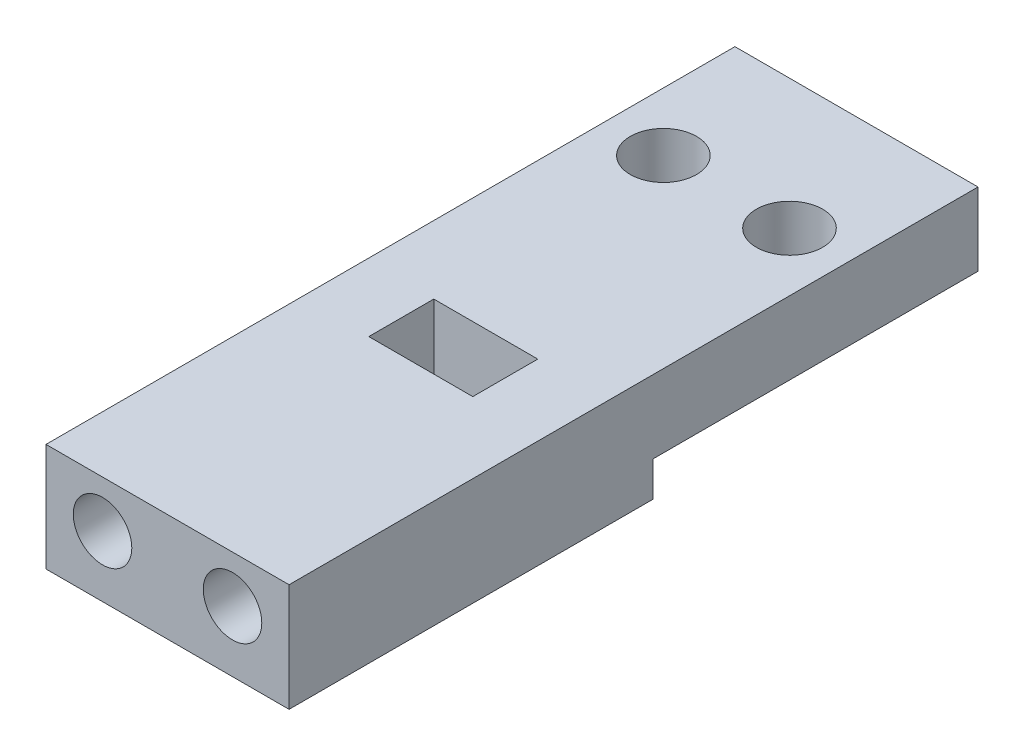
from build123d import *

# Parameters (mm, degrees)
SKETCH_1_W           = 22.333333334
SKETCH_1_H           = 10
EXTRUDE_1_DEPTH      = 30
SKETCH_4_W           = 1.083333334
SKETCH_4_H           = 30
CUT_EXTRUDE_1_DEPTH  = 30
SKETCH_3_R           = 2.25
CUT_EXTRUDE_2_DEPTH  = 15
SKETCH_5_OUTSIDE_W   = 30.87
SKETCH_5_OUTSIDE_H   = 19.62
SKETCH_5_OUTSIDE_W_2 = 18.7
SKETCH_5_OUTSIDE_H_2 = 8.315719237
CUT_EXTRUDE_3_DEPTH  = 30
SKETCH_10_W          = 18.7
SKETCH_10_H          = 8.304405234
EXTRUDE_2_DEPTH      = 18
SKETCH_11_W          = 20
SKETCH_11_H          = 2.687046706
CUT_EXTRUDE_5_DEPTH  = 36.702801011
CUT_EXTRUDE_6_DEPTH  = 32.955789688
SKETCH_13_W          = 18.7
SKETCH_13_H          = 5
EXTRUDE_3_DEPTH      = 5.617358528
SKETCH_14_W          = 8
SKETCH_14_H          = 5
CUT_EXTRUDE_7_DEPTH  = 33.535840608


with BuildPart() as part:
    # 草图1 → 凸台-拉伸1 (new body)
    with BuildSketch(Plane.XY):
        Rectangle(SKETCH_1_W, SKETCH_1_H)
    extrude(amount=EXTRUDE_1_DEPTH)

    # 草图4 → 切除-拉伸1 (cut)
    with BuildSketch(Plane.XZ.offset(5)):
        with Locations((-10.625, 15)):
            Rectangle(SKETCH_4_W, SKETCH_4_H)
    extrude(amount=-CUT_EXTRUDE_1_DEPTH, mode=Mode.SUBTRACT)

    # 草图3 → 切除-拉伸2 (cut)
    with BuildSketch(Plane.XY.offset(30)):
        with Locations((-4.883333333, -0.3)):
            Circle(SKETCH_3_R)
        with Locations((5.116666667, -0.3)):
            Circle(SKETCH_3_R)
    extrude(amount=-CUT_EXTRUDE_2_DEPTH, mode=Mode.SUBTRACT)

    # 草图5 outside → 切除-拉伸3 (cut)
    with BuildSketch(Plane.XY.offset(30)):
        with Locations((0.542, 0)):
            Rectangle(SKETCH_5_OUTSIDE_W, SKETCH_5_OUTSIDE_H)
        with Locations((0.116666667, -0.853454385)):
            Rectangle(SKETCH_5_OUTSIDE_W_2, SKETCH_5_OUTSIDE_H_2, mode=Mode.SUBTRACT)
    extrude(amount=-CUT_EXTRUDE_3_DEPTH, mode=Mode.SUBTRACT)

    # 草图10 → 凸台-拉伸2 (add)
    with BuildSketch(Plane(origin=(0, 0, 0), x_dir=(-1, 0, 0), z_dir=(0, 0, -1))):
        with Locations((-0.116666667, -0.847797383)):
            Rectangle(SKETCH_10_W, SKETCH_10_H)
    extrude(amount=EXTRUDE_2_DEPTH)

    # 草图11 → 切除-拉伸5 (cut, through all)
    with BuildSketch(Plane(origin=(9.466666667, 0, 0), x_dir=(0, 0, -1), z_dir=(1, 0, 0))):
        with Locations((8, -3.656476647)):
            Rectangle(SKETCH_11_W, SKETCH_11_H)
    extrude(amount=-CUT_EXTRUDE_5_DEPTH, mode=Mode.SUBTRACT)

    # 草图12 → 切除-拉伸6 (cut, through all)
    with BuildSketch(Plane.XZ.offset(2.312953294)):
        with BuildLine():
            ThreePointArc((-2.185193673, -12.99813966), (-4.733333333, -10.45), (-7.281472993, -12.99813966))
            Line((-7.281472993, -12.99813966), (-2.185193673, -12.99813966))
        make_face()
        with BuildLine():
            Line((-2.185193673, -12.99813966), (-7.281472993, -12.99813966))
            ThreePointArc((-7.281472993, -12.99813966), (-4.733333333, -15.54627932), (-2.185193673, -12.99813966))
        make_face()
        with BuildLine():
            ThreePointArc((7.514806327, -12.99813966), (4.966666667, -10.45), (2.418527007, -12.99813966))
            Line((2.418527007, -12.99813966), (7.514806327, -12.99813966))
        make_face()
        with BuildLine():
            Line((7.514806327, -12.99813966), (2.418527007, -12.99813966))
            ThreePointArc((2.418527007, -12.99813966), (4.966666667, -15.54627932), (7.514806327, -12.99813966))
        make_face()
    extrude(amount=-CUT_EXTRUDE_6_DEPTH, mode=Mode.SUBTRACT)

    # 草图13 → 凸台-拉伸3 (add)
    with BuildSketch(Plane(origin=(0, 3.304405234, 0), x_dir=(1, 0, 0), z_dir=(0, 1, 0))):
        with Locations((0.116666667, 20.5)):
            Rectangle(SKETCH_13_W, SKETCH_13_H)
    extrude(amount=-EXTRUDE_3_DEPTH)

    # 草图14 → 切除-拉伸7 (cut, through all)
    with BuildSketch(Plane(origin=(0, 3.304405234, 0), x_dir=(1, 0, 0), z_dir=(0, 1, 0))):
        with Locations((0, -7.9)):
            Rectangle(SKETCH_14_W, SKETCH_14_H)
    extrude(amount=-CUT_EXTRUDE_7_DEPTH, mode=Mode.SUBTRACT)


solid = part.part
